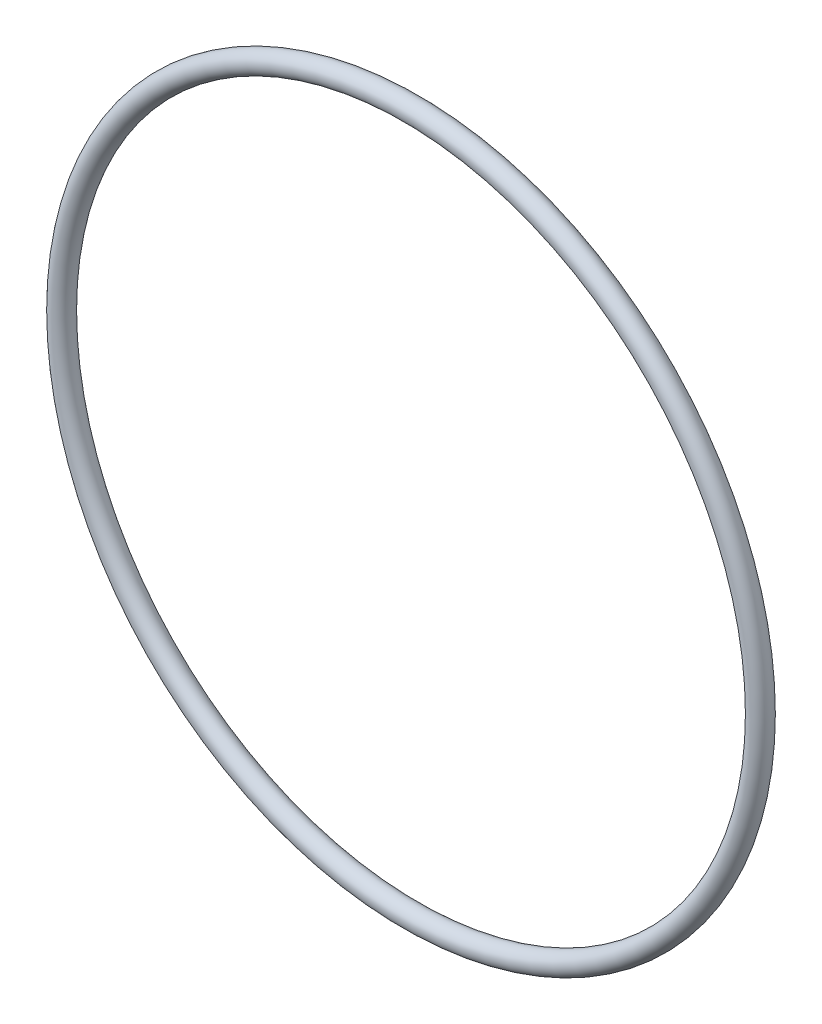
from build123d import *

# Parameters (mm, degrees)
SKETCH1_R = 0.889


with BuildPart() as part:
    # Sketch1 → Revolve1 (revolve)
    with BuildSketch(Plane(origin=(0, 0, 0), x_dir=(0, -1, 0), z_dir=(1, 0, 0)), mode=Mode.PRIVATE) as revolve1_sk:
        with Locations((29.3243, 0)):
            Circle(SKETCH1_R)
    revolve(revolve1_sk.sketch.rotate(Axis((0, 0, 0.889), (0, 0, -1)), 270), axis=Axis((0, 0, 0.889), (0, 0, -1)))


solid = part.part
